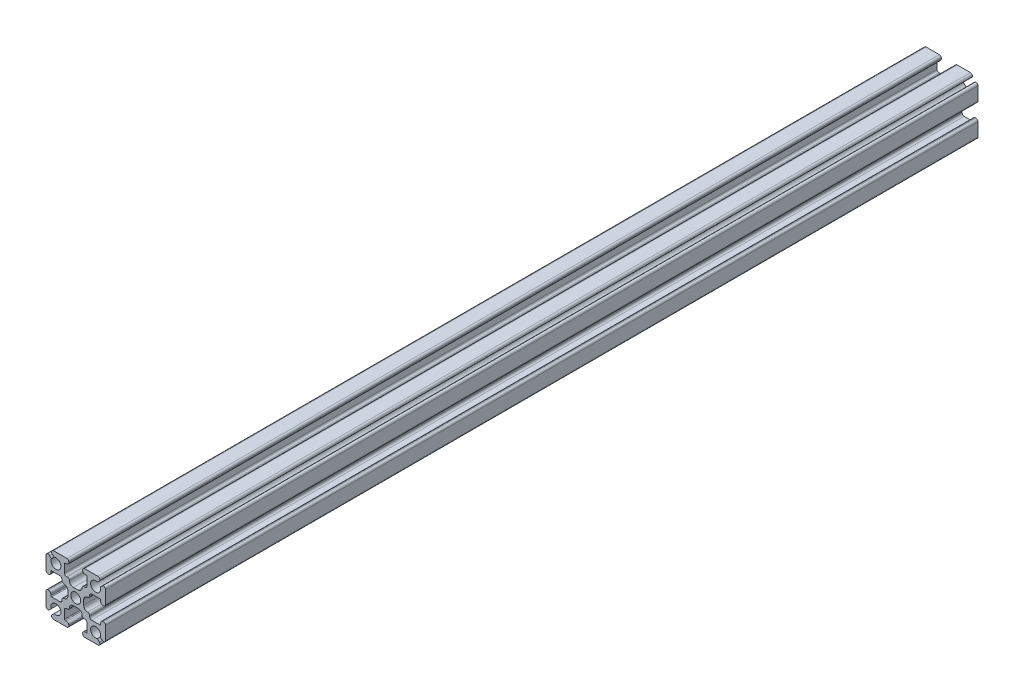
from build123d import *

# Parameters (mm, degrees)
SKETCH1_R           = 1.25
BOSS_EXTRUDE1_DEPTH = 220


with BuildPart() as part:
    # Sketch1 → Boss-Extrude1 (new body)
    with BuildSketch(Plane.XY):
        with BuildLine():
            Line((6.646446609, 5.939339828), (6.163645978, 5.456539197))
            ThreePointArc((6.163645978, 5.456539197), (4.116116524, 4.116116524), (5.456539197, 6.163645978))
            Line((5.456539197, 6.163645978), (5.939339828, 6.646446609))
            ThreePointArc((5.939339828, 6.646446609), (6.047726204, 7.191341716), (5.585786438, 7.5))
            Line((5.585786438, 7.5), (2.25, 7.5))
            ThreePointArc((2.25, 7.5), (1.896446609, 7.353553391), (1.75, 7))
            Line((1.75, 7), (1.75, 6.8))
            ThreePointArc((1.75, 6.8), (1.896446609, 6.446446609), (2.25, 6.3))
            Line((2.25, 6.3), (2.65, 6.3))
            ThreePointArc((2.65, 6.3), (2.791421356, 6.241421356), (2.85, 6.1))
            Line((2.85, 6.1), (2.85, 4))
            ThreePointArc((2.85, 4), (2.703553391, 3.646446609), (2.35, 3.5))
            Line((2.35, 3.5), (2.1, 3.5))
            ThreePointArc((2.1, 3.5), (1.746446609, 3.353553391), (1.6, 3))
            ThreePointArc((1.6, 3), (1.307106781, 2.292893219), (0.6, 2))
            Line((0.6, 2), (-0.6, 2))
            ThreePointArc((-0.6, 2), (-1.307106781, 2.292893219), (-1.6, 3))
            ThreePointArc((-1.6, 3), (-1.746446609, 3.353553391), (-2.1, 3.5))
            Line((-2.1, 3.5), (-2.35, 3.5))
            ThreePointArc((-2.35, 3.5), (-2.703553391, 3.646446609), (-2.85, 4))
            Line((-2.85, 4), (-2.85, 6.1))
            ThreePointArc((-2.85, 6.1), (-2.791421356, 6.241421356), (-2.65, 6.3))
            Line((-2.65, 6.3), (-2.25, 6.3))
            ThreePointArc((-2.25, 6.3), (-1.896446609, 6.446446609), (-1.75, 6.8))
            Line((-1.75, 6.8), (-1.75, 7))
            ThreePointArc((-1.75, 7), (-1.896446609, 7.353553391), (-2.25, 7.5))
            Line((-2.25, 7.5), (-5.585786438, 7.5))
            ThreePointArc((-5.585786438, 7.5), (-6.047726204, 7.191341716), (-5.939339828, 6.646446609))
            Line((-5.939339828, 6.646446609), (-5.456539197, 6.163645978))
            ThreePointArc((-5.456539197, 6.163645978), (-4.116116524, 4.116116524), (-6.163645978, 5.456539197))
            Line((-6.163645978, 5.456539197), (-6.646446609, 5.939339828))
            ThreePointArc((-6.646446609, 5.939339828), (-7.191341716, 6.047726204), (-7.5, 5.585786438))
            Line((-7.5, 5.585786438), (-7.5, 2.25))
            ThreePointArc((-7.5, 2.25), (-7.353553391, 1.896446609), (-7, 1.75))
            Line((-7, 1.75), (-6.8, 1.75))
            ThreePointArc((-6.8, 1.75), (-6.446446609, 1.896446609), (-6.3, 2.25))
            Line((-6.3, 2.25), (-6.3, 2.65))
            ThreePointArc((-6.3, 2.65), (-6.241421356, 2.791421356), (-6.1, 2.85))
            Line((-6.1, 2.85), (-4, 2.85))
            ThreePointArc((-4, 2.85), (-3.646446609, 2.703553391), (-3.5, 2.35))
            Line((-3.5, 2.35), (-3.5, 2.1))
            ThreePointArc((-3.5, 2.1), (-3.353553391, 1.746446609), (-3, 1.6))
            ThreePointArc((-3, 1.6), (-2.292893219, 1.307106781), (-2, 0.6))
            Line((-2, 0.6), (-2, -0.6))
            ThreePointArc((-2, -0.6), (-2.292893219, -1.307106781), (-3, -1.6))
            ThreePointArc((-3, -1.6), (-3.353553391, -1.746446609), (-3.5, -2.1))
            Line((-3.5, -2.1), (-3.5, -2.35))
            ThreePointArc((-3.5, -2.35), (-3.646446609, -2.703553391), (-4, -2.85))
            Line((-4, -2.85), (-6.1, -2.85))
            ThreePointArc((-6.1, -2.85), (-6.241421356, -2.791421356), (-6.3, -2.65))
            Line((-6.3, -2.65), (-6.3, -2.25))
            ThreePointArc((-6.3, -2.25), (-6.446446609, -1.896446609), (-6.8, -1.75))
            Line((-6.8, -1.75), (-7, -1.75))
            ThreePointArc((-7, -1.75), (-7.353553391, -1.896446609), (-7.5, -2.25))
            Line((-7.5, -2.25), (-7.5, -5.585786438))
            ThreePointArc((-7.5, -5.585786438), (-7.191341716, -6.047726204), (-6.646446609, -5.939339828))
            Line((-6.646446609, -5.939339828), (-6.163645978, -5.456539197))
            ThreePointArc((-6.163645978, -5.456539197), (-4.116116524, -4.116116524), (-5.456539197, -6.163645978))
            Line((-5.456539197, -6.163645978), (-5.939339828, -6.646446609))
            ThreePointArc((-5.939339828, -6.646446609), (-6.047726204, -7.191341716), (-5.585786438, -7.5))
            Line((-5.585786438, -7.5), (-2.25, -7.5))
            ThreePointArc((-2.25, -7.5), (-1.896446609, -7.353553391), (-1.75, -7))
            Line((-1.75, -7), (-1.75, -6.8))
            ThreePointArc((-1.75, -6.8), (-1.896446609, -6.446446609), (-2.25, -6.3))
            Line((-2.25, -6.3), (-2.65, -6.3))
            ThreePointArc((-2.65, -6.3), (-2.791421356, -6.241421356), (-2.85, -6.1))
            Line((-2.85, -6.1), (-2.85, -4))
            ThreePointArc((-2.85, -4), (-2.703553391, -3.646446609), (-2.35, -3.5))
            Line((-2.35, -3.5), (-2.1, -3.5))
            ThreePointArc((-2.1, -3.5), (-1.746446609, -3.353553391), (-1.6, -3))
            ThreePointArc((-1.6, -3), (-1.307106781, -2.292893219), (-0.6, -2))
            Line((-0.6, -2), (0.6, -2))
            ThreePointArc((0.6, -2), (1.307106781, -2.292893219), (1.6, -3))
            ThreePointArc((1.6, -3), (1.746446609, -3.353553391), (2.1, -3.5))
            Line((2.1, -3.5), (2.35, -3.5))
            ThreePointArc((2.35, -3.5), (2.703553391, -3.646446609), (2.85, -4))
            Line((2.85, -4), (2.85, -6.1))
            ThreePointArc((2.85, -6.1), (2.791421356, -6.241421356), (2.65, -6.3))
            Line((2.65, -6.3), (2.25, -6.3))
            ThreePointArc((2.25, -6.3), (1.896446609, -6.446446609), (1.75, -6.8))
            Line((1.75, -6.8), (1.75, -7))
            ThreePointArc((1.75, -7), (1.896446609, -7.353553391), (2.25, -7.5))
            Line((2.25, -7.5), (5.585786438, -7.5))
            ThreePointArc((5.585786438, -7.5), (6.047726204, -7.191341716), (5.939339828, -6.646446609))
            Line((5.939339828, -6.646446609), (5.456539197, -6.163645978))
            ThreePointArc((5.456539197, -6.163645978), (4.116116524, -4.116116524), (6.163645978, -5.456539197))
            Line((6.163645978, -5.456539197), (6.646446609, -5.939339828))
            ThreePointArc((6.646446609, -5.939339828), (7.191341716, -6.047726204), (7.5, -5.585786438))
            Line((7.5, -5.585786438), (7.5, -2.25))
            ThreePointArc((7.5, -2.25), (7.353553391, -1.896446609), (7, -1.75))
            Line((7, -1.75), (6.8, -1.75))
            ThreePointArc((6.8, -1.75), (6.446446609, -1.896446609), (6.3, -2.25))
            Line((6.3, -2.25), (6.3, -2.65))
            ThreePointArc((6.3, -2.65), (6.241421356, -2.791421356), (6.1, -2.85))
            Line((6.1, -2.85), (4, -2.85))
            ThreePointArc((4, -2.85), (3.646446609, -2.703553391), (3.5, -2.35))
            Line((3.5, -2.35), (3.5, -2.1))
            ThreePointArc((3.5, -2.1), (3.353553391, -1.746446609), (3, -1.6))
            ThreePointArc((3, -1.6), (2.292893219, -1.307106781), (2, -0.6))
            Line((2, -0.6), (2, 0.6))
            ThreePointArc((2, 0.6), (2.292893219, 1.307106781), (3, 1.6))
            ThreePointArc((3, 1.6), (3.353553391, 1.746446609), (3.5, 2.1))
            Line((3.5, 2.1), (3.5, 2.35))
            ThreePointArc((3.5, 2.35), (3.646446609, 2.703553391), (4, 2.85))
            Line((4, 2.85), (6.1, 2.85))
            ThreePointArc((6.1, 2.85), (6.241421356, 2.791421356), (6.3, 2.65))
            Line((6.3, 2.65), (6.3, 2.25))
            ThreePointArc((6.3, 2.25), (6.446446609, 1.896446609), (6.8, 1.75))
            Line((6.8, 1.75), (7, 1.75))
            ThreePointArc((7, 1.75), (7.353553391, 1.896446609), (7.5, 2.25))
            Line((7.5, 2.25), (7.5, 5.585786438))
            ThreePointArc((7.5, 5.585786438), (7.191341716, 6.047726204), (6.646446609, 5.939339828))
        make_face()
        with Locations(Location((0, 0, 0), (0, 0, 180))):
            Circle(SKETCH1_R, mode=Mode.SUBTRACT)
    extrude(amount=BOSS_EXTRUDE1_DEPTH)


solid = part.part
